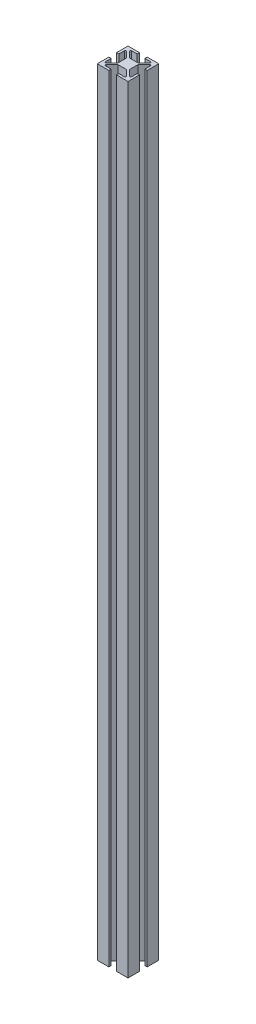
from build123d import *

# Parameters (mm, degrees)
BOSS_EXTRU_1_DEPTH = 505


with BuildPart() as part:
    # Esquisse1 → Boss.-Extru.1 (new body)
    with BuildSketch(Plane(origin=(0, 0, 0), x_dir=(1, 0, 0), z_dir=(0, 1, 0))):
        with BuildLine():
            Line((-10, -2.5), (-10, -10))
            Line((-10, -10), (-2.5, -10))
            Line((-2.5, -10), (-2.5, -8.5))
            Line((-2.5, -8.5), (-6.232233047, -8.5))
            ThreePointArc((-6.232233047, -8.5), (-6.694172813, -8.191341716), (-6.585786438, -7.646446609))
            Line((-6.585786438, -7.646446609), (-2.689339828, -3.75))
            Line((-2.689339828, -3.75), (2.689339828, -3.75))
            Line((2.689339828, -3.75), (6.585786438, -7.646446609))
            ThreePointArc((6.585786438, -7.646446609), (6.694172813, -8.191341716), (6.232233047, -8.5))
            Line((6.232233047, -8.5), (2.5, -8.5))
            Line((2.5, -8.5), (2.5, -10))
            Line((2.5, -10), (10, -10))
            Line((10, -10), (10, -2.5))
            Line((10, -2.5), (8.5, -2.5))
            Line((8.5, -2.5), (8.5, -6.232233047))
            ThreePointArc((8.5, -6.232233047), (8.191341716, -6.694172813), (7.646446609, -6.585786438))
            Line((7.646446609, -6.585786438), (3.75, -2.689339828))
            Line((3.75, -2.689339828), (3.75, 2.689339828))
            Line((3.75, 2.689339828), (7.646446609, 6.585786438))
            ThreePointArc((7.646446609, 6.585786438), (8.191341716, 6.694172813), (8.5, 6.232233047))
            Line((8.5, 6.232233047), (8.5, 2.5))
            Line((8.5, 2.5), (10, 2.5))
            Line((10, 2.5), (10, 10))
            Line((10, 10), (2.5, 10))
            Line((2.5, 10), (2.5, 8.5))
            Line((2.5, 8.5), (6.232233047, 8.5))
            ThreePointArc((6.232233047, 8.5), (6.694172813, 8.191341716), (6.585786438, 7.646446609))
            Line((6.585786438, 7.646446609), (2.689339828, 3.75))
            Line((2.689339828, 3.75), (-2.689339828, 3.75))
            Line((-2.689339828, 3.75), (-6.585786438, 7.646446609))
            ThreePointArc((-6.585786438, 7.646446609), (-6.694172813, 8.191341716), (-6.232233047, 8.5))
            Line((-6.232233047, 8.5), (-2.5, 8.5))
            Line((-2.5, 8.5), (-2.5, 10))
            Line((-2.5, 10), (-10, 10))
            Line((-10, 10), (-10, 2.5))
            Line((-10, 2.5), (-8.5, 2.5))
            Line((-8.5, 2.5), (-8.5, 6.232233047))
            ThreePointArc((-8.5, 6.232233047), (-8.191341716, 6.694172813), (-7.646446609, 6.585786438))
            Line((-7.646446609, 6.585786438), (-3.75, 2.689339828))
            Line((-3.75, 2.689339828), (-3.75, -2.689339828))
            Line((-3.75, -2.689339828), (-7.646446609, -6.585786438))
            ThreePointArc((-7.646446609, -6.585786438), (-8.191341716, -6.694172813), (-8.5, -6.232233047))
            Line((-8.5, -6.232233047), (-8.5, -2.5))
            Line((-8.5, -2.5), (-10, -2.5))
        make_face()
    extrude(amount=BOSS_EXTRU_1_DEPTH)


solid = part.part
